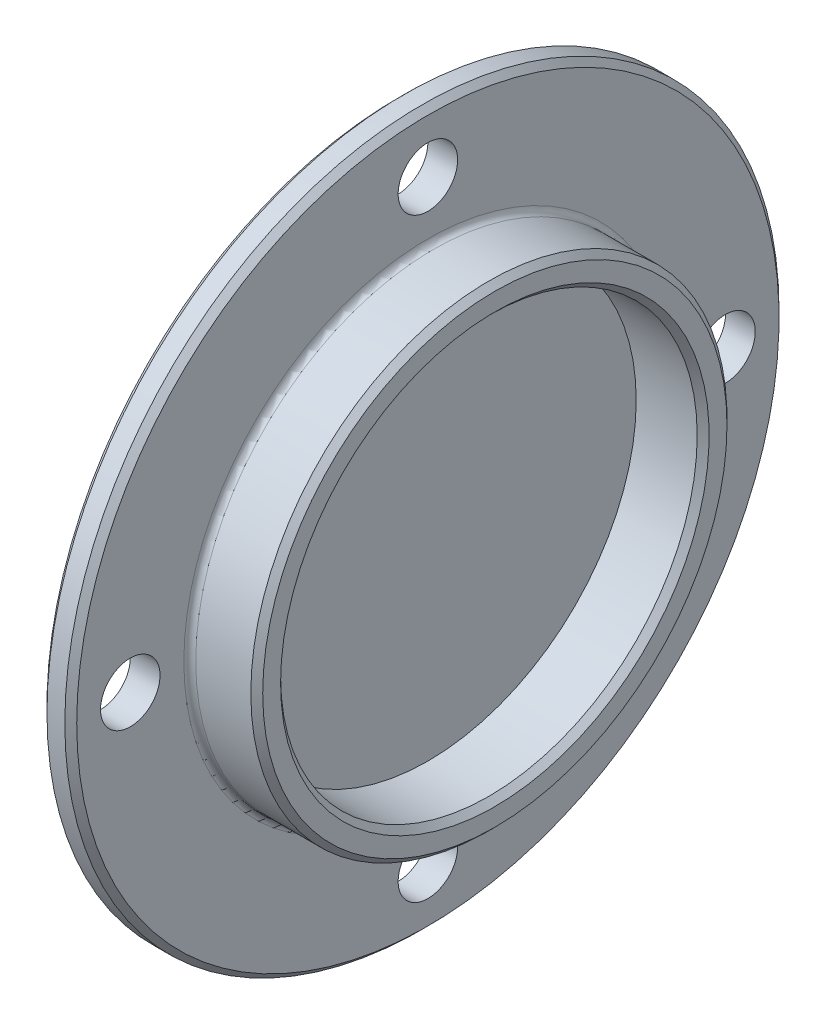
from build123d import *

# Parameters (mm, degrees)
CUT_EXTRUDE_3_DEPTH      = 173.789611956
CUT_EXTRUDE_3_DEPTH_BACK = 173.789611956
SKETCH_2_R               = 10
FILLET_1_R               = 2
CHAMFER_1_SIZE           = 2


with BuildPart() as part:
    # 草图1 → 旋转1 (revolve)
    with BuildSketch(Plane.XY, mode=Mode.PRIVATE) as revolve_1_sk:
        Polygon((0, 0), (10, 0), (10, 70), (32.5, 70), (32.5, 80), (10, 80), (10, 120), (0, 120), align=None)
    revolve(revolve_1_sk.sketch.rotate(Axis((-39.78021978, 0, 0), (1, 0, 0)), 90), axis=Axis((-39.78021978, 0, 0), (1, 0, 0)))

    # 草图2 → 切除-拉伸3 (cut, two sides: drawn at the far end of the back side and taken through both)
    with BuildSketch(Plane(origin=(0, 0, 0), x_dir=(0, 0, -1), z_dir=(1, 0, 0)).offset(-CUT_EXTRUDE_3_DEPTH_BACK)):
        with Locations(Location((100, 0, 0), (0, 0, 180))):
            Circle(SKETCH_2_R)
        with Locations(Location((0, -100, 0), (0, 0, 180))):
            Circle(SKETCH_2_R)
        with Locations(Location((-100, 0, 0), (0, 0, 180))):
            Circle(SKETCH_2_R)
        with Locations(Location((0, 100, 0), (0, 0, 180))):
            Circle(SKETCH_2_R)
    extrude(amount=CUT_EXTRUDE_3_DEPTH + CUT_EXTRUDE_3_DEPTH_BACK, mode=Mode.SUBTRACT)

    # 圆角1
    fillet_1_edges = [part.edges().sort_by_distance(p)[0] for p in [
        (10, 0, -80),
    ]]
    fillet(fillet_1_edges, radius=FILLET_1_R)

    # 倒角1
    chamfer_1_edges = [part.edges().sort_by_distance(p)[0] for p in [
        (0, 0, -120),
        (10, 0, -120),
        (32.5, 0, -80),
        (32.5, 0, -70),
    ]]
    chamfer(chamfer_1_edges, length=CHAMFER_1_SIZE)


solid = part.part
